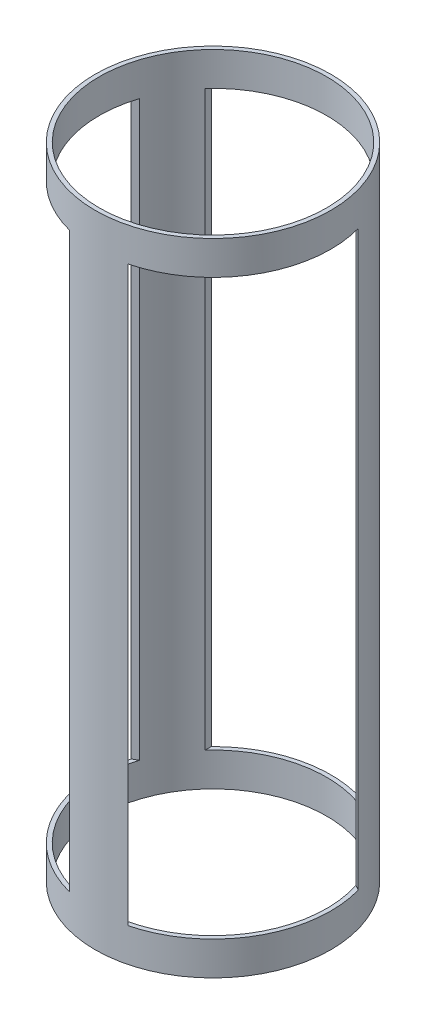
from build123d import *

# Parameters (mm, degrees)
SKETCH1_R               = 88.9
SKETCH1_R_2             = 85.725
BOSS_EXTRUDE1_DEPTH     = 241.427
CUT_EXTRUDE1_REACH      = 274.201
CUT_EXTRUDE1_END_RADIUS = 88.9
SKETCH2_W               = 127
SKETCH2_H               = 432.054
CIRPATTERN1_COUNT       = 3


with BuildPart() as part:
    # Sketch1 → Boss-Extrude1 (new, symmetric)
    with BuildSketch(Plane(origin=(0, 0, 0), x_dir=(1, 0, 0), z_dir=(0, 1, 0))):
        with Locations(Location((0, 0, 0), (0, 0, 270))):
            Circle(SKETCH1_R)
        with Locations(Location((0, 0, 0), (0, 0, 270))):
            Circle(SKETCH1_R_2, mode=Mode.SUBTRACT)
    extrude(amount=BOSS_EXTRUDE1_DEPTH, both=True)

    # Cut-Extrude1: up to this cylinder (the profile starts inside it)
    cut_extrude1_end = Plane(origin=(0, 0, 0), z_dir=(0, -1, 0)) * Cylinder(CUT_EXTRUDE1_END_RADIUS, 727.202, mode=Mode.PRIVATE)
    # Sketch2 → Cut-Extrude1 (cut, up to the surface)
    with BuildSketch(Plane.XY, mode=Mode.PRIVATE) as cut_extrude1_sk1:
        Rectangle(SKETCH2_W, SKETCH2_H)
    cut_extrude1_tool1 = extrude(cut_extrude1_sk1.sketch, amount=-CUT_EXTRUDE1_REACH, mode=Mode.PRIVATE) & cut_extrude1_end
    cut_extrude1 = cut_extrude1_tool1.solids().sort_by_distance((0, 0, 0))[0]
    add(cut_extrude1, mode=Mode.SUBTRACT)

    # CirPattern1: Cut-Extrude1 ×3 about axis
    cirpattern1_axis = Axis((0, 0, 0), (0, 1, 0))
    for i in range(1, CIRPATTERN1_COUNT):
        add(cut_extrude1.rotate(cirpattern1_axis, i * 360 / CIRPATTERN1_COUNT), mode=Mode.SUBTRACT)


solid = part.part
